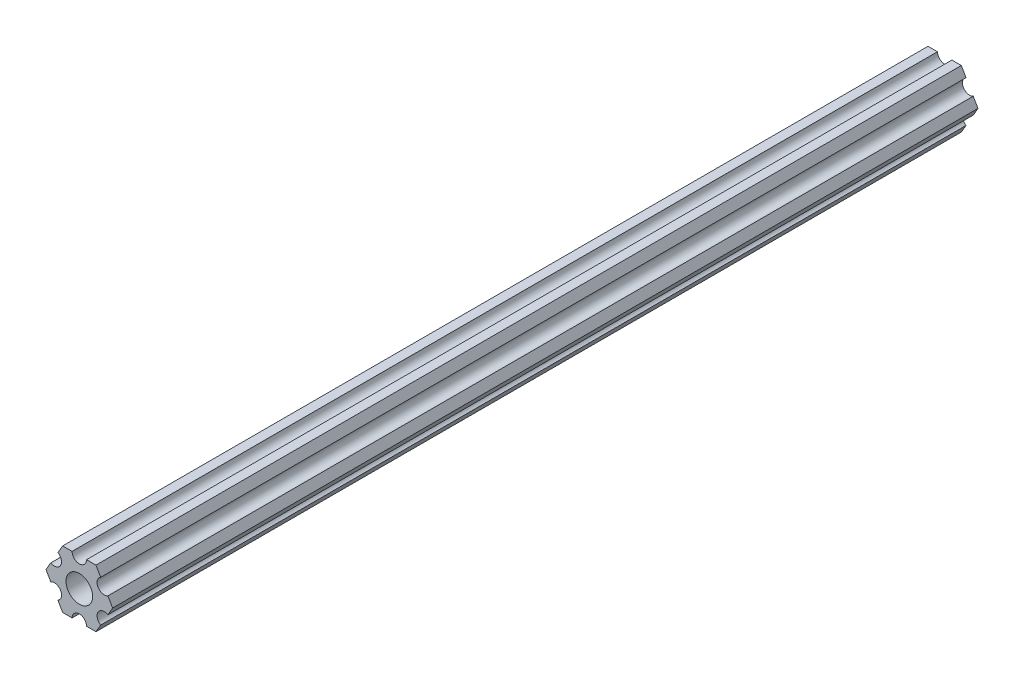
from build123d import *

# Parameters (mm, degrees)
SKETCH1_R           = 2.9337
BOSS_EXTRUDE1_DEPTH = 190.5


with BuildPart() as part:
    # Sketch1 → Boss-Extrude1 (new body)
    with BuildSketch(Plane.XY.offset(304.8)):
        with BuildLine():
            Line((6.293011699, -1.800184894), (7.332348803, -2.22e-07))
            Line((7.332348803, -2.22e-07), (6.293011439, 1.800184522))
            ThreePointArc((6.293011439, 1.800184522), (4.124446058, 2.381249653), (4.705511189, 4.549815034))
            Line((4.705511189, 4.549815034), (3.666173825, 6.349999778))
            Line((3.666173825, 6.349999778), (1.587499615, 6.349999778))
            ThreePointArc((1.587499615, 6.349999778), (-3.85e-07, 4.762499778), (-1.587500385, 6.349999778))
            Line((-1.587500385, 6.349999778), (-3.666174594, 6.349999778))
            Line((-3.666174594, 6.349999778), (-4.70551159, 4.549815043))
            ThreePointArc((-4.70551159, 4.549815043), (-4.12444613, 2.38124975), (-6.293011423, 1.80018429))
            Line((-6.293011423, 1.80018429), (-7.332348419, -4.44e-07))
            Line((-7.332348419, -4.44e-07), (-6.293011205, -1.800185053))
            ThreePointArc((-6.293011205, -1.800185053), (-4.124445841, -2.38125025), (-4.705511038, -4.549815614))
            Line((-4.705511038, -4.549815614), (-3.666173825, -6.350000222))
            Line((-3.666173825, -6.350000222), (-1.587499615, -6.350000222))
            ThreePointArc((-1.587499615, -6.350000222), (3.85e-07, -4.762500222), (1.587500385, -6.350000222))
            Line((1.587500385, -6.350000222), (3.666174594, -6.350000222))
            Line((3.666174594, -6.350000222), (4.705511699, -4.549815551))
            ThreePointArc((4.705511699, -4.549815551), (4.12444637, -2.381250222), (6.293011699, -1.800184894))
        make_face()
        with Locations(Location((0, 0, 0), (0, 0, 180))):
            Circle(SKETCH1_R, mode=Mode.SUBTRACT)
    extrude(amount=-BOSS_EXTRUDE1_DEPTH)


solid = part.part
